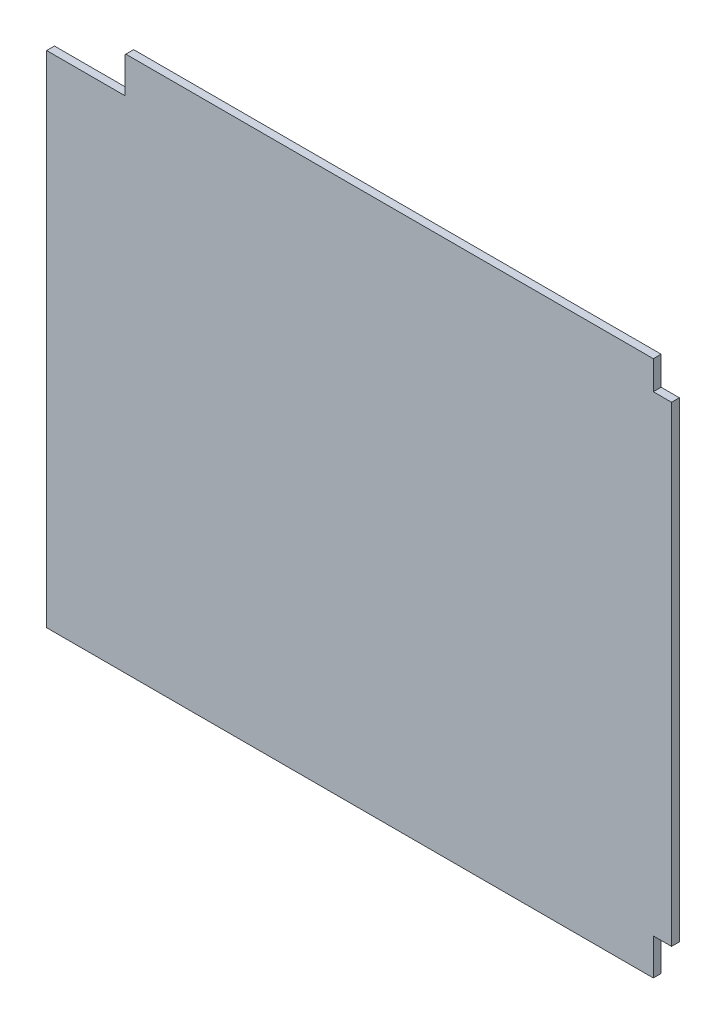
from build123d import *

# Parameters (mm, degrees)
BOSS_EXTRUDE1_DEPTH = 3


with BuildPart() as part:
    # Sketch1 → Boss-Extrude1 (new body)
    with BuildSketch(Plane.XY):
        Polygon((-87.03845954, 82.449635922), (-117.03845954, 82.449635922), (-117.03845954, -109.550364078), (115.96154046, -109.550364078), (115.96154046, -95.550364078), (122.96154046, -95.550364078), (122.96154046, 85.449635922), (115.96154046, 85.449635922), (115.96154046, 96.449635922), (-74.03845954, 96.449635922), (-86.624245977, 96.449635922), (-87.03845954, 96.03542236), align=None)
    extrude(amount=BOSS_EXTRUDE1_DEPTH)


solid = part.part
